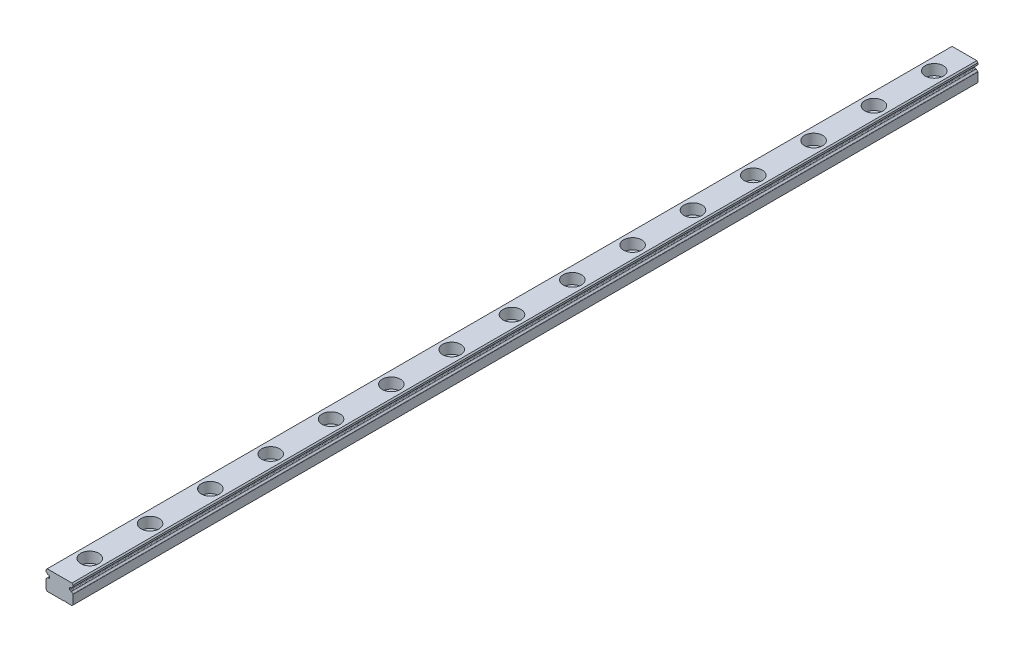
from build123d import *

# Parameters (mm, degrees)
BOSS_EXTRUDE1_START = 150
BOSS_EXTRUDE1_DEPTH = 300
LPATTERN1_COUNT     = 15
LPATTERN1_PITCH     = 20


with BuildPart() as part:
    # Sketch3 → Boss-Extrude1 (new body)
    with BuildSketch(Plane.XY.offset(BOSS_EXTRUDE1_START)):
        with BuildLine():
            Line((-4.5, 0.191696476), (-4.5, -2.85))
            Line((-4.5, -2.85), (-4.1, -3.25))
            Line((-4.1, -3.25), (1.4, -3.25))
            ThreePointArc((1.4, -3.25), (1.8, -3.05), (2.2, -3.25))
            Line((2.2, -3.25), (4.1, -3.25))
            Line((4.1, -3.25), (4.5, -2.85))
            Line((4.5, -2.85), (4.5, 0.191696476))
            ThreePointArc((4.5, 0.191696476), (4.475108648, 0.274448068), (4.408695652, 0.329735674))
            ThreePointArc((4.408695652, 0.329735674), (4.141262777, 0.497623907), (3.939510483, 0.740528855))
            ThreePointArc((3.939510483, 0.740528855), (3.890337026, 0.791057421), (3.823510417, 0.813537838))
            Line((3.823510417, 0.813537838), (3.482568852, 0.84336636))
            ThreePointArc((3.482568852, 0.84336636), (3.352544533, 0.907487258), (3.3, 1.042605299))
            Line((3.3, 1.042605299), (3.3, 1.457394701))
            ThreePointArc((3.3, 1.457394701), (3.352544533, 1.592512742), (3.482568852, 1.65663364))
            Line((3.482568852, 1.65663364), (3.823514163, 1.68646249))
            ThreePointArc((3.823514163, 1.68646249), (3.890340367, 1.708942652), (3.939513741, 1.759470648))
            ThreePointArc((3.939513741, 1.759470648), (4.141265182, 2.002372199), (4.408695652, 2.170258326))
            ThreePointArc((4.408695652, 2.170258326), (4.475108648, 2.225545932), (4.5, 2.308297524))
            Line((4.5, 2.308297524), (4.5, 2.85))
            Line((4.5, 2.85), (4.1, 3.25))
            Line((4.1, 3.25), (-4.1, 3.25))
            Line((-4.1, 3.25), (-4.5, 2.85))
            Line((-4.5, 2.85), (-4.5, 2.308297524))
            ThreePointArc((-4.5, 2.308297524), (-4.475108648, 2.225545932), (-4.408695652, 2.170258326))
            ThreePointArc((-4.408695652, 2.170258326), (-4.141265182, 2.002372199), (-3.939513741, 1.759470648))
            ThreePointArc((-3.939513741, 1.759470648), (-3.890340367, 1.708942652), (-3.823514163, 1.68646249))
            Line((-3.823514163, 1.68646249), (-3.482568852, 1.65663364))
            ThreePointArc((-3.482568852, 1.65663364), (-3.352544533, 1.592512742), (-3.3, 1.457394701))
            Line((-3.3, 1.457394701), (-3.3, 1.042605299))
            ThreePointArc((-3.3, 1.042605299), (-3.352544533, 0.907487258), (-3.482568852, 0.84336636))
            Line((-3.482568852, 0.84336636), (-3.823510417, 0.813537838))
            ThreePointArc((-3.823510417, 0.813537838), (-3.890337026, 0.791057421), (-3.939510483, 0.740528855))
            ThreePointArc((-3.939510483, 0.740528855), (-4.141262777, 0.497623907), (-4.408695652, 0.329735674))
            ThreePointArc((-4.408695652, 0.329735674), (-4.475108648, 0.274448068), (-4.5, 0.191696476))
        make_face()
    extrude(amount=-BOSS_EXTRUDE1_DEPTH)

    # Sketch4 → Cut-Revolve1 (revolve, cut)
    with BuildSketch(Plane.XY.offset(140)):
        Polygon((0, 3.25), (0, -3.25), (-1.75, -3.25), (-1.75, -0.25), (-3, -0.25), (-3, 3.25), align=None)
    cut_revolve1 = revolve(axis=Axis((0, 3.25, 140), (0, -1, 0)), mode=Mode.SUBTRACT)

    # LPattern1: Cut-Revolve1 ×15
    with Locations(*[(0, 0, -i * LPATTERN1_PITCH) for i in range(1, LPATTERN1_COUNT)]):
        add(cut_revolve1, mode=Mode.SUBTRACT)


solid = part.part
